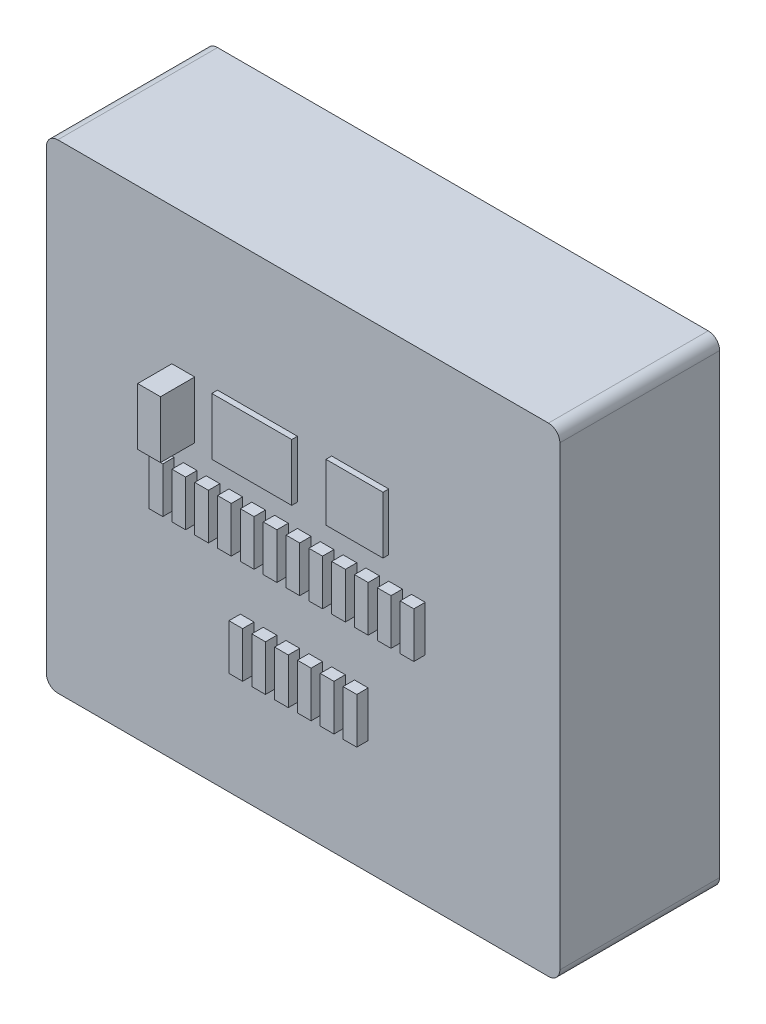
from build123d import *

# Parameters (mm, degrees)
BOSS_EXTRUDE1_DEPTH = 14
SKETCH2_W           = 7
SKETCH2_H           = 5
SKETCH2_W_2         = 5
BOSS_EXTRUDE2_DEPTH = 0.5
SKETCH3_W           = 1.2
SKETCH3_H           = 4
BOSS_EXTRUDE3_DEPTH = 1
SKETCH4_W           = 2
SKETCH4_H           = 5
BOSS_EXTRUDE4_DEPTH = 3


with BuildPart() as part:
    # Sketch1 → Boss-Extrude1 (new body)
    with BuildSketch(Plane.XY):
        with BuildLine():
            Line((1, 0), (44, 0))
            ThreePointArc((44, 0), (44.707106781, 0.292893219), (45, 1))
            Line((45, 1), (45, 41))
            ThreePointArc((45, 41), (44.707106781, 41.707106781), (44, 42))
            Line((44, 42), (1, 42))
            ThreePointArc((1, 42), (0.292893219, 41.707106781), (0, 41))
            Line((0, 41), (0, 1))
            ThreePointArc((0, 1), (0.292893219, 0.292893219), (1, 0))
        make_face()
    extrude(amount=BOSS_EXTRUDE1_DEPTH)

    # Sketch2 → Boss-Extrude2 (add)
    with BuildSketch(Plane.XY.offset(14)):
        with Locations((18.5, 27.5)):
            Rectangle(SKETCH2_W, SKETCH2_H)
        with Locations((27.5, 27.5)):
            Rectangle(SKETCH2_W_2, SKETCH2_H)
    extrude(amount=BOSS_EXTRUDE2_DEPTH)

    # Sketch3 → Boss-Extrude3 (add)
    with BuildSketch(Plane.XY.offset(14)):
        with Locations((10.6, 21)):
            Rectangle(SKETCH3_W, SKETCH3_H)
        with Locations((12.6, 21)):
            Rectangle(SKETCH3_W, SKETCH3_H)
        with Locations((14.6, 21)):
            Rectangle(SKETCH3_W, SKETCH3_H)
        with Locations((16.6, 21)):
            Rectangle(SKETCH3_W, SKETCH3_H)
        with Locations((18.6, 21)):
            Rectangle(SKETCH3_W, SKETCH3_H)
        with Locations((20.6, 21)):
            Rectangle(SKETCH3_W, SKETCH3_H)
        with Locations((22.6, 21)):
            Rectangle(SKETCH3_W, SKETCH3_H)
        with Locations((24.6, 21)):
            Rectangle(SKETCH3_W, SKETCH3_H)
        with Locations((26.6, 21)):
            Rectangle(SKETCH3_W, SKETCH3_H)
        with Locations((28.6, 21)):
            Rectangle(SKETCH3_W, SKETCH3_H)
        with Locations((30.6, 21)):
            Rectangle(SKETCH3_W, SKETCH3_H)
        with Locations((32.6, 21)):
            Rectangle(SKETCH3_W, SKETCH3_H)
        with Locations((19.6, 12)):
            Rectangle(SKETCH3_W, SKETCH3_H)
        with Locations((17.6, 12)):
            Rectangle(SKETCH3_W, SKETCH3_H)
        with Locations((21.6, 12)):
            Rectangle(SKETCH3_W, SKETCH3_H)
        with Locations((23.6, 12)):
            Rectangle(SKETCH3_W, SKETCH3_H)
        with Locations((25.6, 12)):
            Rectangle(SKETCH3_W, SKETCH3_H)
        with Locations((27.6, 12)):
            Rectangle(SKETCH3_W, SKETCH3_H)
    extrude(amount=BOSS_EXTRUDE3_DEPTH)

    # Sketch4 → Boss-Extrude4 (add)
    with BuildSketch(Plane.XY.offset(14)):
        with Locations((12, 27.5)):
            Rectangle(SKETCH4_W, SKETCH4_H)
    extrude(amount=BOSS_EXTRUDE4_DEPTH)


solid = part.part
